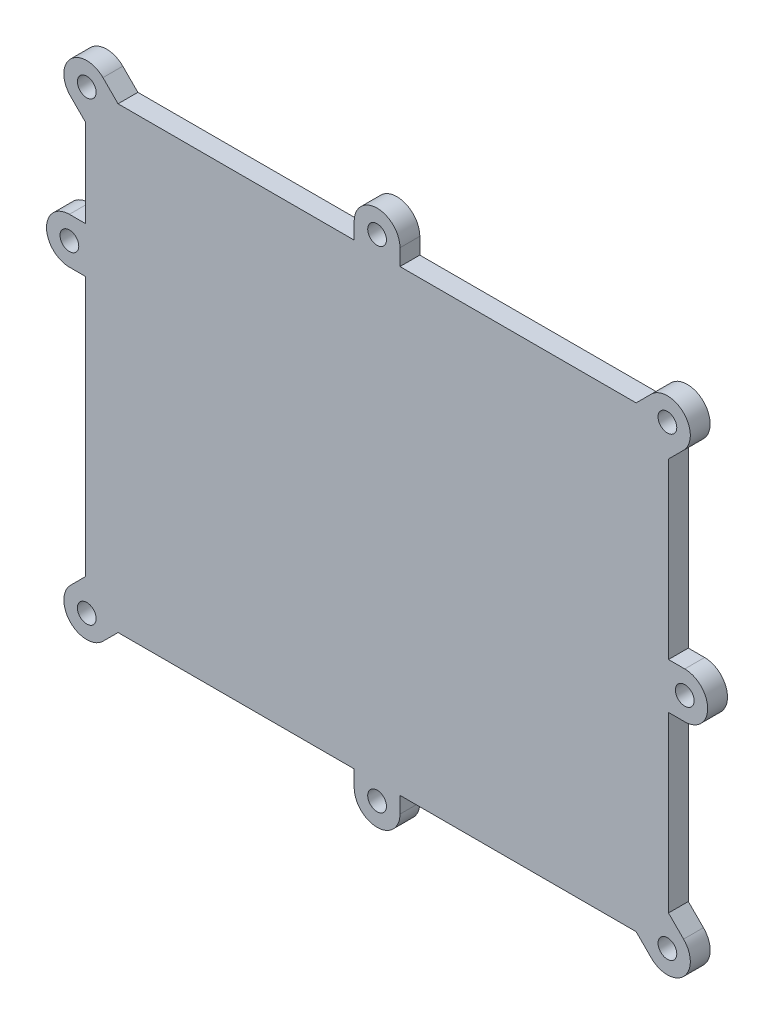
from build123d import *

# Parameters (mm, degrees)
BOSS_EXTRUDE1_DEPTH  = 4.7625
M4_CLEARANCE_HOLE1_D = 4.5


with BuildPart() as part:
    # Sketch1 → Boss-Extrude1 (new body)
    with BuildSketch(Plane.XY):
        with BuildLine():
            Line((-3.626904156, -9.820077826), (0, -13.446981982))
            Line((0, -13.446981982), (0, -33.529852105))
            Line((0, -33.529852105), (0, -34.502807389))
            Line((0, -34.502807389), (-3.9097, -34.502807389))
            ThreePointArc((-3.9097, -34.502807389), (-9.4097, -40.002807389), (-3.9097, -45.502807389))
            Line((-3.9097, -45.502807389), (0, -45.502807389))
            Line((0, -45.502807389), (0, -46.902807389))
            Line((0, -46.902807389), (0, -51.502807389))
            Line((0, -51.502807389), (0, -107.890632795))
            Line((0, -107.890632795), (-3.626904156, -111.517536951))
            ThreePointArc((-3.626904156, -111.517536951), (-3.626904156, -119.295711544), (4.151270437, -119.295711544))
            Line((4.151270437, -119.295711544), (7.778174593, -115.668807389))
            Line((7.778174593, -115.668807389), (64.5, -115.668807389))
            Line((64.5, -115.668807389), (64.5, -119.578507389))
            ThreePointArc((64.5, -119.578507389), (70, -125.078507389), (75.5, -119.578507389))
            Line((75.5, -119.578507389), (75.5, -115.668807389))
            Line((75.5, -115.668807389), (132.221825407, -115.668807389))
            Line((132.221825407, -115.668807389), (135.848729563, -119.295711544))
            ThreePointArc((135.848729563, -119.295711544), (143.626904156, -119.295711544), (143.626904156, -111.517536951))
            Line((143.626904156, -111.517536951), (140, -107.890632795))
            Line((140, -107.890632795), (140, -66.168807389))
            Line((140, -66.168807389), (143.9097, -66.168807389))
            ThreePointArc((143.9097, -66.168807389), (149.4097, -60.668807389), (143.9097, -55.168807389))
            Line((143.9097, -55.168807389), (140, -55.168807389))
            Line((140, -55.168807389), (140, -13.446981982))
            Line((140, -13.446981982), (143.626904156, -9.820077826))
            ThreePointArc((143.626904156, -9.820077826), (143.626904156, -2.041903233), (135.848729563, -2.041903233))
            Line((135.848729563, -2.041903233), (132.221825407, -5.668807389))
            Line((132.221825407, -5.668807389), (75.5, -5.668807389))
            Line((75.5, -5.668807389), (75.5, -1.759107389))
            ThreePointArc((75.5, -1.759107389), (70, 3.740892611), (64.5, -1.759107389))
            Line((64.5, -1.759107389), (64.5, -5.668807389))
            Line((64.5, -5.668807389), (7.778174593, -5.668807389))
            Line((7.778174593, -5.668807389), (4.151270437, -2.041903233))
            ThreePointArc((4.151270437, -2.041903233), (-3.626904156, -2.041903233), (-3.626904156, -9.820077826))
        make_face()
    extrude(amount=BOSS_EXTRUDE1_DEPTH)

    # M4 Clearance Hole1 (through all)
    with Locations(Plane.XY.offset(4.7625)):
        with Locations((0.262183141, -5.930990529), (-3.9097, -40.002807389), (0.262183141, -115.406624248), (70, -119.578507389), (139.737816859, -115.406624248), (143.9097, -60.668807389), (139.737816859, -5.930990529), (70, -1.759107389)):
            Hole(M4_CLEARANCE_HOLE1_D / 2)


solid = part.part
